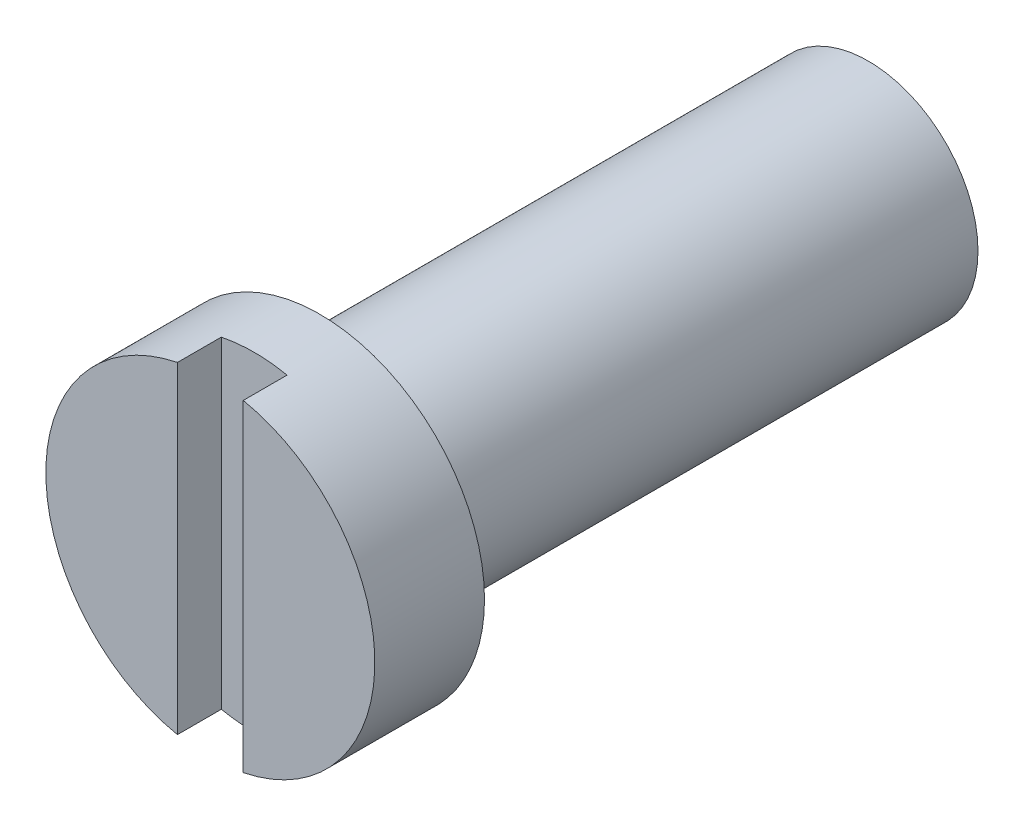
from build123d import *

# Parameters (mm, degrees)
SKETCH1_R           = 0.5
BOSS_EXTRUDE1_DEPTH = 2.5
SKETCH2_R           = 0.75
BOSS_EXTRUDE2_DEPTH = 0.5
CUT_EXTRUDE1_START  = -0.2
CUT_EXTRUDE1_DEPTH  = 0.2


with BuildPart() as part:
    # Sketch1 → Boss-Extrude1 (new body)
    with BuildSketch(Plane.XY):
        Circle(SKETCH1_R)
    extrude(amount=BOSS_EXTRUDE1_DEPTH)

    # Sketch2 → Boss-Extrude2 (add)
    with BuildSketch(Plane.XY.offset(2.5)):
        Circle(SKETCH2_R)
    extrude(amount=BOSS_EXTRUDE2_DEPTH)

    # Sketch3 → Cut-Extrude1 (cut)
    with BuildSketch(Plane.XY.offset(3).offset(CUT_EXTRUDE1_START)):
        with BuildLine():
            Line((0.15, 0.734846923), (0.15, -0.734846923))
            ThreePointArc((0.15, -0.734846923), (0, -0.75), (-0.15, -0.734846923))
            Line((-0.15, -0.734846923), (-0.15, 0.734846923))
            ThreePointArc((-0.15, 0.734846923), (0, 0.75), (0.15, 0.734846923))
        make_face()
    extrude(amount=CUT_EXTRUDE1_DEPTH, mode=Mode.SUBTRACT)


solid = part.part
